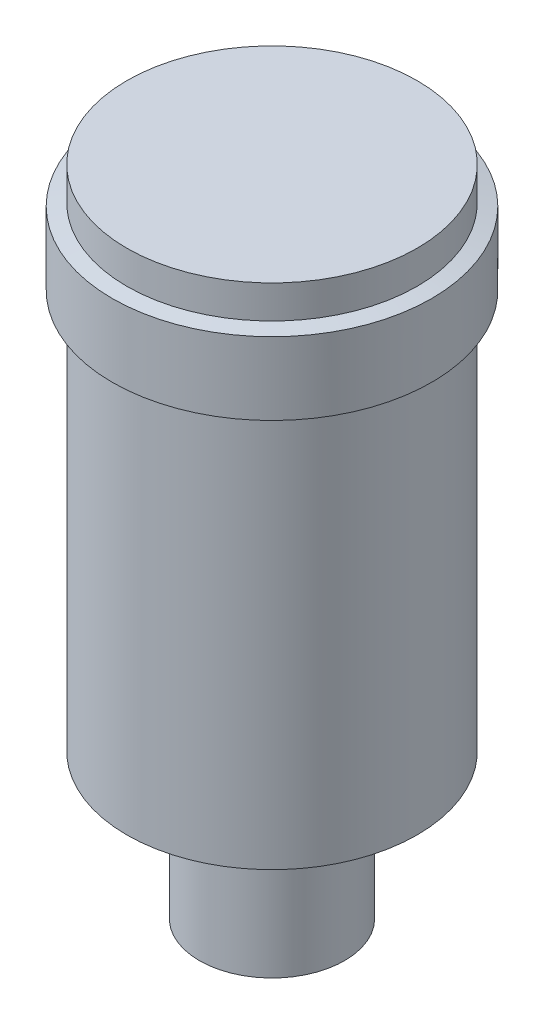
from build123d import *

# Parameters (mm, degrees)
SKETCH_1_R      = 1
EXTRUDE_1_DEPTH = 2
SKETCH_2_R      = 2
EXTRUDE_2_DEPTH = 7


with BuildPart() as part:
    # 草图1 → 凸台-拉伸1 (new body)
    with BuildSketch(Plane(origin=(0, 0, 0), x_dir=(1, 0, 0), z_dir=(0, 1, 0))):
        with Locations(Location((0, 0, 0), (0, 0, 270))):
            Circle(SKETCH_1_R)
    extrude(amount=EXTRUDE_1_DEPTH)

    # 草图2 → 凸台-拉伸2 (add)
    with BuildSketch(Plane(origin=(0, 2, 0), x_dir=(1, 0, 0), z_dir=(0, 1, 0))):
        with Locations(Location((0, 0, 0), (0, 0, 270))):
            Circle(SKETCH_2_R)
    extrude(amount=EXTRUDE_2_DEPTH)

    # 草图3 → 旋转1 (revolve)
    with BuildSketch(Plane.XY, mode=Mode.PRIVATE) as revolve_1_sk:
        Polygon((0, 9), (0, 7), (2.2, 7.5), (2.2, 8.5), align=None)
    revolve(revolve_1_sk.sketch.rotate(Axis((0, 9, 0), (0, -1, 0)), 90), axis=Axis((0, 9, 0), (0, -1, 0)))


solid = part.part
